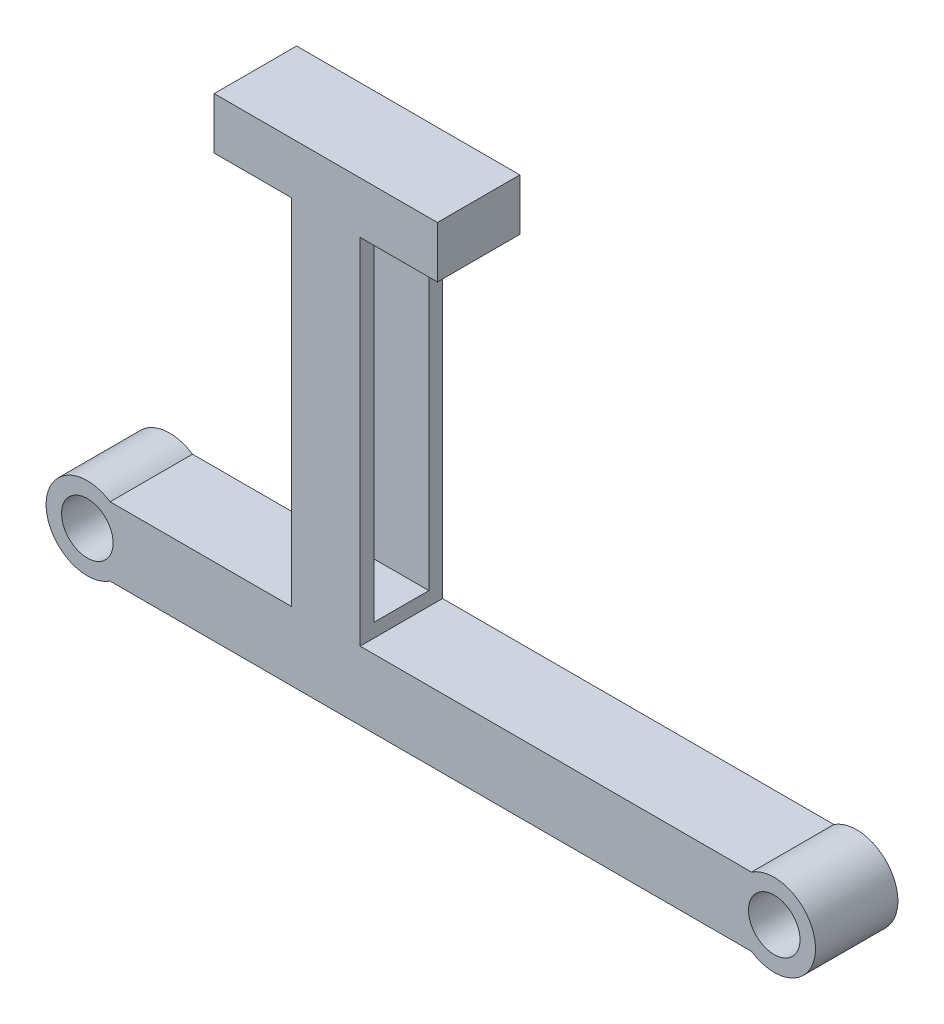
from build123d import *

# Parameters (mm, degrees)
BOSS_EXTRUDE1_DEPTH      = 12
BOSS_EXTRUDE1_DEPTH_BACK = 12
SKETCH1_R                = 7.5
CUT_EXTRUDE1_DEPTH       = 183.477874792
CUT_EXTRUDE1_DEPTH_BACK  = 183.477874792
SKETCH2_W                = 16
SKETCH2_H                = 95.07


with BuildPart() as part:
    # Sketch1 → Boss-Extrude1 (new, two sides: drawn at the far end of the back side and taken through both)
    with BuildSketch(Plane.XY.offset(-BOSS_EXTRUDE1_DEPTH_BACK)):
        with BuildLine():
            ThreePointArc((-49.084636864, 6.747346105), (-67.717886444, -3.252653895), (-49.084636864, -13.252653895))
            Line((-49.084636864, -13.252653895), (137.648863975, -13.252653895))
            ThreePointArc((137.648863975, -13.252653895), (156.282113556, -3.252653895), (137.648863975, 6.747346105))
            Line((137.648863975, 6.747346105), (23.712113556, 6.747346105))
            Line((23.712113556, 6.747346105), (23.712113556, 109.817346105))
            Line((23.712113556, 109.817346105), (46.212113556, 109.817346105))
            Line((46.212113556, 109.817346105), (46.212113556, 124.817346105))
            Line((46.212113556, 124.817346105), (-18.787886444, 124.817346105))
            Line((-18.787886444, 124.817346105), (-18.787886444, 109.817346105))
            Line((-18.787886444, 109.817346105), (3.712113556, 109.817346105))
            Line((3.712113556, 109.817346105), (3.712113556, 6.747346105))
            Line((3.712113556, 6.747346105), (-49.084636864, 6.747346105))
        make_face()
        with Locations((-55.717886444, -3.252653895)):
            Circle(SKETCH1_R, mode=Mode.SUBTRACT)
        with Locations((144.282113556, -3.252653895)):
            Circle(SKETCH1_R, mode=Mode.SUBTRACT)
    extrude(amount=BOSS_EXTRUDE1_DEPTH + BOSS_EXTRUDE1_DEPTH_BACK)

    # Sketch2 → Cut-Extrude1 (cut, two sides: drawn at the far end of the back side and taken through both)
    with BuildSketch(Plane(origin=(23.712113556, 0, 0), x_dir=(0, 0, -1), z_dir=(1, 0, 0)).offset(-CUT_EXTRUDE1_DEPTH_BACK)):
        with Locations((0, 58.282346105)):
            Rectangle(SKETCH2_W, SKETCH2_H)
    extrude(amount=CUT_EXTRUDE1_DEPTH + CUT_EXTRUDE1_DEPTH_BACK, mode=Mode.SUBTRACT)


solid = part.part
